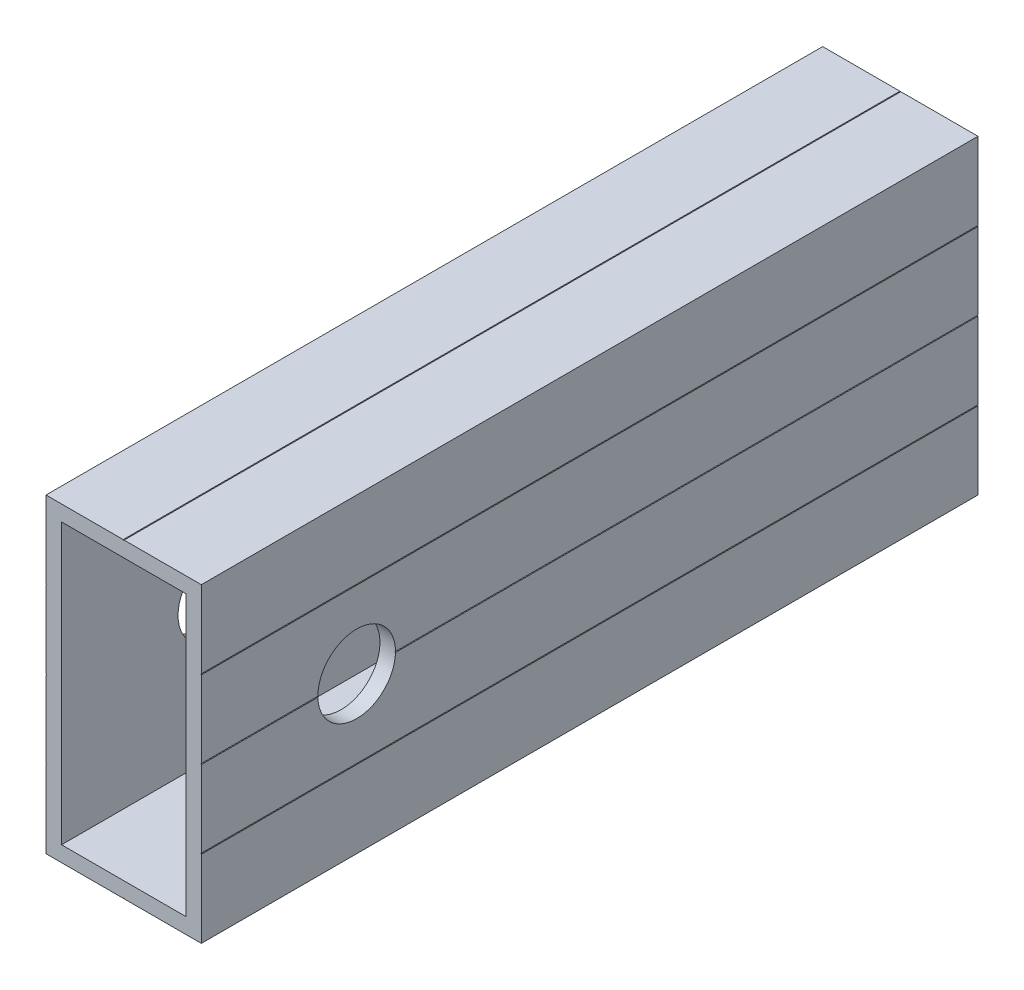
from build123d import *

# Parameters (mm, degrees)
SKETCH1_W           = 1498.6
SKETCH1_H           = 50.8
BOSS_EXTRUDE1_DEPTH = 25.4
CUT_EXTRUDE1_DEPTH  = 1498.6
CUT_EXTRUDE2_DEPTH  = 1499.869043646
CUT_EXTRUDE3_DEPTH  = 1498.6
CUT_EXTRUDE4_DEPTH  = 1498.6
CUT_EXTRUDE5_DEPTH  = 1499.869043646
CUT_EXTRUDE6_DEPTH  = 1499.869043646
CUT_EXTRUDE7_DEPTH  = 1498.6
CUT_EXTRUDE8_DEPTH  = 1498.6
SKETCH10_W          = 20.32
SKETCH10_H          = 45.72
CUT_EXTRUDE9_DEPTH  = 1499.869043646
DRAFT1_ANGLE        = 45
DRAFT2_ANGLE        = 45.000000005
DRAFT3_ANGLE        = 45
DRAFT4_ANGLE        = 45
DRAFT5_ANGLE        = 45
DRAFT6_ANGLE        = 44.999999995
SKETCH11_W          = 61.962293059
SKETCH11_H          = 88.678950317
CUT_EXTRUDE10_DEPTH = 1371.6
SKETCH13_R          = 6.35
CUT_EXTRUDE11_DEPTH = 25.4


with BuildPart() as part:
    # Sketch1 → Boss-Extrude1 (new body)
    with BuildSketch(Plane(origin=(12.7, 0, 0), x_dir=(0, 0, -1), z_dir=(1, 0, 0))):
        Rectangle(SKETCH1_W, SKETCH1_H)
    extrude(amount=-BOSS_EXTRUDE1_DEPTH)

    # Sketch2 → Cut-Extrude1 (cut)
    with BuildSketch(Plane.XY.offset(749.3)):
        Polygon((0.0762, 25.4), (-0.0762, 25.4), (0.0762, 25.2476), align=None)
    extrude(amount=-CUT_EXTRUDE1_DEPTH, mode=Mode.SUBTRACT)

    # Sketch3 → Cut-Extrude2 (cut, through all)
    with BuildSketch(Plane.XY.offset(749.3)):
        Polygon((12.7, 12.6238), (12.7, 12.7762), (12.5476, 12.7762), align=None)
    extrude(amount=-CUT_EXTRUDE2_DEPTH, mode=Mode.SUBTRACT)

    # Sketch4 → Cut-Extrude3 (cut)
    with BuildSketch(Plane.XY.offset(749.3)):
        Polygon((12.7, -0.0762), (12.7, 0.0762), (12.5476, -0.0762), align=None)
    extrude(amount=-CUT_EXTRUDE3_DEPTH, mode=Mode.SUBTRACT)

    # Sketch5 → Cut-Extrude4 (cut)
    with BuildSketch(Plane.XY.offset(749.3)):
        Polygon((12.7, -12.7762), (12.7, -12.6238), (12.5476, -12.6238), align=None)
    extrude(amount=-CUT_EXTRUDE4_DEPTH, mode=Mode.SUBTRACT)

    # Sketch6 → Cut-Extrude5 (cut, through all)
    with BuildSketch(Plane.XY.offset(749.3)):
        Polygon((0.0762, -25.4), (-0.0762, -25.2476), (-0.0762, -25.4), align=None)
    extrude(amount=-CUT_EXTRUDE5_DEPTH, mode=Mode.SUBTRACT)

    # Sketch7 → Cut-Extrude6 (cut, through all)
    with BuildSketch(Plane.XY.offset(749.3)):
        Polygon((-12.7, -12.6238), (-12.7, -12.7762), (-12.5476, -12.7762), align=None)
    extrude(amount=-CUT_EXTRUDE6_DEPTH, mode=Mode.SUBTRACT)

    # Sketch8 → Cut-Extrude7 (cut)
    with BuildSketch(Plane.XY.offset(749.3)):
        Polygon((-12.7, 0.0762), (-12.7, -0.0762), (-12.5476, 0.0762), align=None)
    extrude(amount=-CUT_EXTRUDE7_DEPTH, mode=Mode.SUBTRACT)

    # Sketch9 → Cut-Extrude8 (cut)
    with BuildSketch(Plane.XY.offset(749.3)):
        Polygon((-12.7, 12.7762), (-12.7, 12.6238), (-12.5476, 12.6238), align=None)
    extrude(amount=-CUT_EXTRUDE8_DEPTH, mode=Mode.SUBTRACT)

    # Sketch10 → Cut-Extrude9 (cut, through all)
    with BuildSketch(Plane.XY.offset(749.3)):
        Rectangle(SKETCH10_W, SKETCH10_H)
    extrude(amount=-CUT_EXTRUDE9_DEPTH, mode=Mode.SUBTRACT)

    # Draft1
    draft1_faces = [part.faces().sort_by_distance(p)[0] for p in [
        (0.0762, 25.3238, 0),
    ]]
    draft(draft1_faces, Plane(origin=(-12.7, 25.4, -749.3), x_dir=(0, 0, 1), z_dir=(0, 1, 0)), DRAFT1_ANGLE)

    # Draft2
    draft2_faces = [part.faces().sort_by_distance(p)[0] for p in [
        (12.6238, 12.7762, 0),
    ]]
    draft(draft2_faces, Plane(origin=(12.7, 0, 0), x_dir=(0, 0, 1), z_dir=(1, 0, 0)), DRAFT2_ANGLE)

    # Draft3
    draft3_faces = [part.faces().sort_by_distance(p)[0] for p in [
        (-0.0762, -25.3238, 0),
    ]]
    draft(draft3_faces, Plane(origin=(-12.7, -25.4, 749.3), x_dir=(0, 0, -1), z_dir=(0, -1, 0)), DRAFT3_ANGLE)

    # Draft4
    draft4_faces = [part.faces().sort_by_distance(p)[0] for p in [
        (-12.6238, -12.7762, 0),
    ]]
    draft(draft4_faces, Plane(origin=(-12.7, 0, 0), x_dir=(0, 0, -1), z_dir=(-1, 0, 0)), DRAFT4_ANGLE)

    # Draft5
    draft5_faces = [part.faces().sort_by_distance(p)[0] for p in [
        (12.6238, -12.6238, 0),
        (12.6238, 0, 0),
    ]]
    draft(draft5_faces, Plane(origin=(12.7, 0, 0), x_dir=(0, 0, 1), z_dir=(1, 0, 0)), DRAFT5_ANGLE)

    # Draft6
    draft6_faces = [part.faces().sort_by_distance(p)[0] for p in [
        (-12.6238, 0, 0),
        (-12.6238, 12.6238, 0),
    ]]
    draft(draft6_faces, Plane(origin=(-12.7, 0, 0), x_dir=(0, 0, -1), z_dir=(-1, 0, 0)), DRAFT6_ANGLE)

    # Sketch11 → Cut-Extrude10 (cut)
    with BuildSketch(Plane(origin=(0, 0, -749.3), x_dir=(-1, 0, 0), z_dir=(0, 0, -1))):
        with Locations((-2.92473676, 0.325700182)):
            Rectangle(SKETCH11_W, SKETCH11_H)
    extrude(amount=-CUT_EXTRUDE10_DEPTH, mode=Mode.SUBTRACT)

    # Sketch13 → Cut-Extrude11 (cut)
    with BuildSketch(Plane(origin=(12.7, 0, 0), x_dir=(0, 0, -1), z_dir=(1, 0, 0))):
        with Locations((-723.9, 0.0762)):
            Circle(SKETCH13_R)
    extrude(amount=-CUT_EXTRUDE11_DEPTH, mode=Mode.SUBTRACT)


solid = part.part
